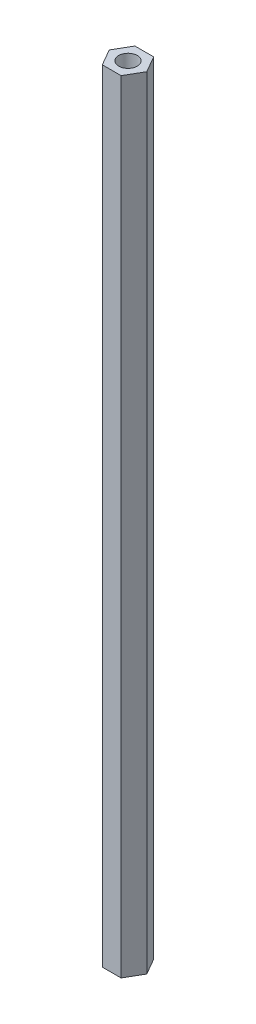
from build123d import *

# Parameters (mm, degrees)
SKETCH1_R           = 2
BOSS_EXTRUDE1_DEPTH = 168


with BuildPart() as part:
    # Sketch1 → Boss-Extrude1 (new body)
    with BuildSketch(Plane(origin=(0, 0, 0), x_dir=(1, 0, 0), z_dir=(0, 1, 0))):
        Polygon((-2.020725942, 3.5), (-4.041451884, 0), (-2.020725942, -3.5), (2.020725942, -3.5), (4.041451884, 0), (2.020725942, 3.5), align=None)
        with Locations(Location((0, 0, 0), (0, 0, 90))):
            Circle(SKETCH1_R, mode=Mode.SUBTRACT)
    extrude(amount=BOSS_EXTRUDE1_DEPTH)


solid = part.part
